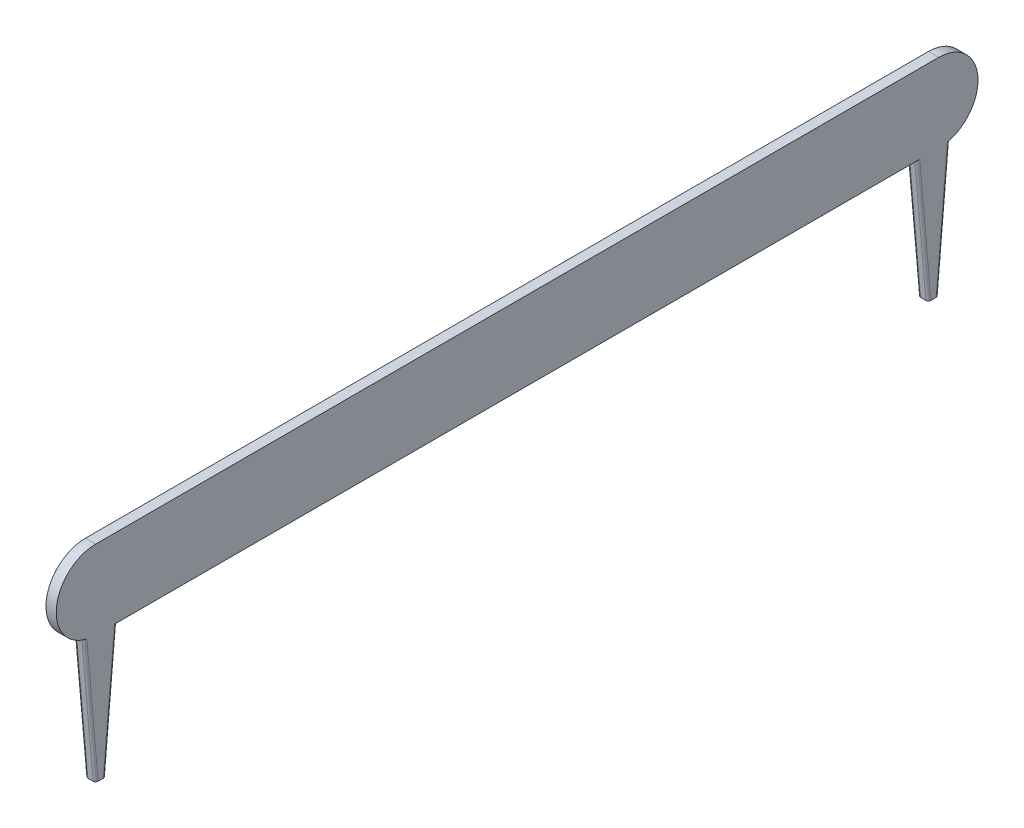
from build123d import *

# Parameters (mm, degrees)
BOSS_EXTRUDE1_DEPTH       = 20
SKETCH2_W                 = 20
SKETCH2_H                 = 20
BOSS_EXTRUDE2_DEPTH       = 250
DRAFT5_ANGLE              = 5
FILLET1_R                 = 5
DRAFT5_OF_MIRROR2_2_ANGLE = 5
FILLET1_OF_MIRROR2_R      = 5


with BuildPart() as part:
    # Sketch1 → Boss-Extrude1 (new body)
    with BuildSketch(Plane(origin=(0, 0, 0), x_dir=(0, 0, -1), z_dir=(1, 0, 0))):
        with BuildLine():
            Line((-824.175, -50), (824.175, -50))
            ThreePointArc((824.175, -50), (901.175, 27), (824.175, 104))
            Line((824.175, 104), (-824.175, 104))
            ThreePointArc((-824.175, 104), (-901.175, 27), (-824.175, -50))
        make_face()
    extrude(amount=BOSS_EXTRUDE1_DEPTH)

    # Sketch2 → Boss-Extrude2 (add)
    with BuildSketch(Plane.XZ.offset(50)):
        with Locations((10, 814.175)):
            Rectangle(SKETCH2_W, SKETCH2_H)
    boss_extrude2 = extrude(amount=BOSS_EXTRUDE2_DEPTH)

    # Draft5
    draft5_faces = [part.faces().sort_by_distance(p)[0] for p in [
        (10, -175, 824.175),
        (10, -175, 804.175),
    ]]
    draft(draft5_faces, Plane(origin=(0, -300, 0), x_dir=(0, 0, -1), z_dir=(0, -1, 0)), DRAFT5_ANGLE)

    # Fillet1
    fillet1_edges = [part.edges().sort_by_distance(p)[0] for p in [
        (0, -173.371611905, 835.253548439),
        (0, -175, 793.238917059),
        (20, -175, 793.238917059),
        (20, -173.371611905, 835.253548439),
    ]]
    fillet(fillet1_edges, radius=FILLET1_R)

    # Mirror2: Boss-Extrude2 across plane
    add(boss_extrude2.mirror(Plane.XY))

    # Draft5 of Mirror2 2
    draft5_of_mirror2_2_faces = [part.faces().sort_by_distance(p)[0] for p in [
        (10, -175, -824.175),
        (10, -175, -804.175),
    ]]
    draft(draft5_of_mirror2_2_faces, Plane(origin=(0, -300, 0), x_dir=(0, 0, 1), z_dir=(0, -1, 0)), DRAFT5_OF_MIRROR2_2_ANGLE)

    # Fillet1 of Mirror2
    fillet1_of_mirror2_edges = [part.edges().sort_by_distance(p)[0] for p in [
        (0, -173.371611905, -835.253548439),
        (0, -175, -793.238917059),
        (20, -175, -793.238917059),
        (20, -173.371611905, -835.253548439),
    ]]
    fillet(fillet1_of_mirror2_edges, radius=FILLET1_OF_MIRROR2_R)


solid = part.part
